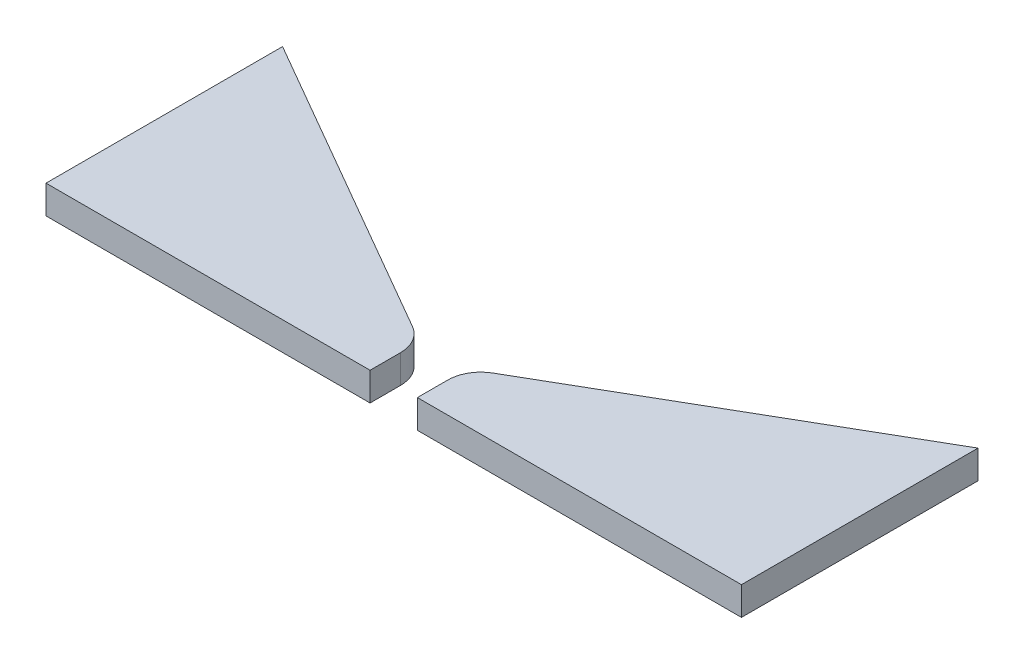
from build123d import *

# Parameters (mm, degrees)
BOSS_EXTRUDE1_DEPTH                   = 19.05
BOSS_EXTRUDE1_2_DEPTH                 = 19.05
F_1_8_0_125_DIAMETER_HOLE1_AT_2_COUNT = 2
F_1_8_0_125_DIAMETER_HOLE1_AT_2_PITCH = 76.2
F_1_8_0_125_DIAMETER_HOLE1_AT_3_COUNT = 2
F_1_8_0_125_DIAMETER_HOLE1_AT_3_PITCH = 159.130543894
F_1_8_0_125_DIAMETER_HOLE1_AT_4_COUNT = 2
F_1_8_0_125_DIAMETER_HOLE1_AT_4_PITCH = 286.542650621
F_1_8_0_125_DIAMETER_HOLE1_AT_5_COUNT = 2
F_1_8_0_125_DIAMETER_HOLE1_AT_5_PITCH = 422.847544187
F_1_8_0_125_DIAMETER_HOLE1_AT_6_COUNT = 2
F_1_8_0_125_DIAMETER_HOLE1_AT_6_PITCH = 415.925


with BuildPart() as part:
    # Sketch1 → Boss-Extrude1 (new body)
    with BuildSketch(Plane(origin=(0, 0, 0), x_dir=(1, 0, 0), z_dir=(0, 1, 0))):
        with BuildLine():
            ThreePointArc((-26.9875, 39.599338196), (-18.852585401, 31.464423597), (-15.875, 20.351923597))
            Line((-15.875, 20.351923597), (-15.875, 0))
            Line((-15.875, 0), (-233.3625, 0))
            Line((-233.3625, 0), (-233.3625, 158.75))
            Line((-233.3625, 158.75), (-26.9875, 39.599338196))
        make_face()
    extrude(amount=BOSS_EXTRUDE1_DEPTH)


with BuildPart() as body_2:
    # Sketch1 → Boss-Extrude1 2 (new body)
    with BuildSketch(Plane(origin=(0, 0, 0), x_dir=(1, 0, 0), z_dir=(0, 1, 0))):
        with BuildLine():
            Line((233.3625, 158.75), (26.9875, 39.599338196))
            ThreePointArc((26.9875, 39.599338196), (18.852585401, 31.464423597), (15.875, 20.351923597))
            Line((15.875, 20.351923597), (15.875, 0))
            Line((15.875, 0), (233.3625, 0))
            Line((233.3625, 0), (233.3625, 158.75))
        make_face()
    extrude(amount=BOSS_EXTRUDE1_2_DEPTH)

    # Sketch3 → 1/8 (0.125) Diameter Hole1 (revolve, cut)
    with BuildSketch(Plane(origin=(207.9625, 0, -101.6), x_dir=(0, 0, -1), z_dir=(1, 0, 0))):
        Polygon((0, 0), (0, 12.066366233), (1.5875, 11.1125), (1.5875, 0), align=None)
    f_1_8_0_125_diameter_hole1 = revolve(axis=Axis((207.9625, -6.35, -101.6), (0, 1, 0)), mode=Mode.SUBTRACT)

    # 1/8 (0.125) Diameter Hole1 at 2: 1/8 (0.125) Diameter Hole1 ×2
    with Locations(*[(0, 0, i * F_1_8_0_125_DIAMETER_HOLE1_AT_2_PITCH) for i in range(1, F_1_8_0_125_DIAMETER_HOLE1_AT_2_COUNT)]):
        add(f_1_8_0_125_diameter_hole1, mode=Mode.SUBTRACT)

    # 1/8 (0.125) Diameter Hole1 at 3: 1/8 (0.125) Diameter Hole1 ×2
    with Locations(*[Vector(-0.8778955729143845, 0, 0.4788521306805733) * (i * F_1_8_0_125_DIAMETER_HOLE1_AT_3_PITCH) for i in range(1, F_1_8_0_125_DIAMETER_HOLE1_AT_3_COUNT)]):
        add(f_1_8_0_125_diameter_hole1, mode=Mode.SUBTRACT)


with BuildPart() as part_1:
    add(part.part)

    # 1/8 (0.125) Diameter Hole1 at 4: 1/8 (0.125) Diameter Hole1 ×2
    with Locations(*[Vector(-0.9639926182060737, 0, 0.2659289981258134) * (i * F_1_8_0_125_DIAMETER_HOLE1_AT_4_PITCH) for i in range(1, F_1_8_0_125_DIAMETER_HOLE1_AT_4_COUNT)]):
        add(f_1_8_0_125_diameter_hole1, mode=Mode.SUBTRACT)

    # 1/8 (0.125) Diameter Hole1 at 5: 1/8 (0.125) Diameter Hole1 ×2
    with Locations(*[Vector(-0.9836287468564193, 0, 0.1802067933172066) * (i * F_1_8_0_125_DIAMETER_HOLE1_AT_5_PITCH) for i in range(1, F_1_8_0_125_DIAMETER_HOLE1_AT_5_COUNT)]):
        add(f_1_8_0_125_diameter_hole1, mode=Mode.SUBTRACT)

    # 1/8 (0.125) Diameter Hole1 at 6: 1/8 (0.125) Diameter Hole1 ×2
    with Locations(*[(-i * F_1_8_0_125_DIAMETER_HOLE1_AT_6_PITCH, 0, 0) for i in range(1, F_1_8_0_125_DIAMETER_HOLE1_AT_6_COUNT)]):
        add(f_1_8_0_125_diameter_hole1, mode=Mode.SUBTRACT)


solid = Compound([body_2.part, part_1.part])
